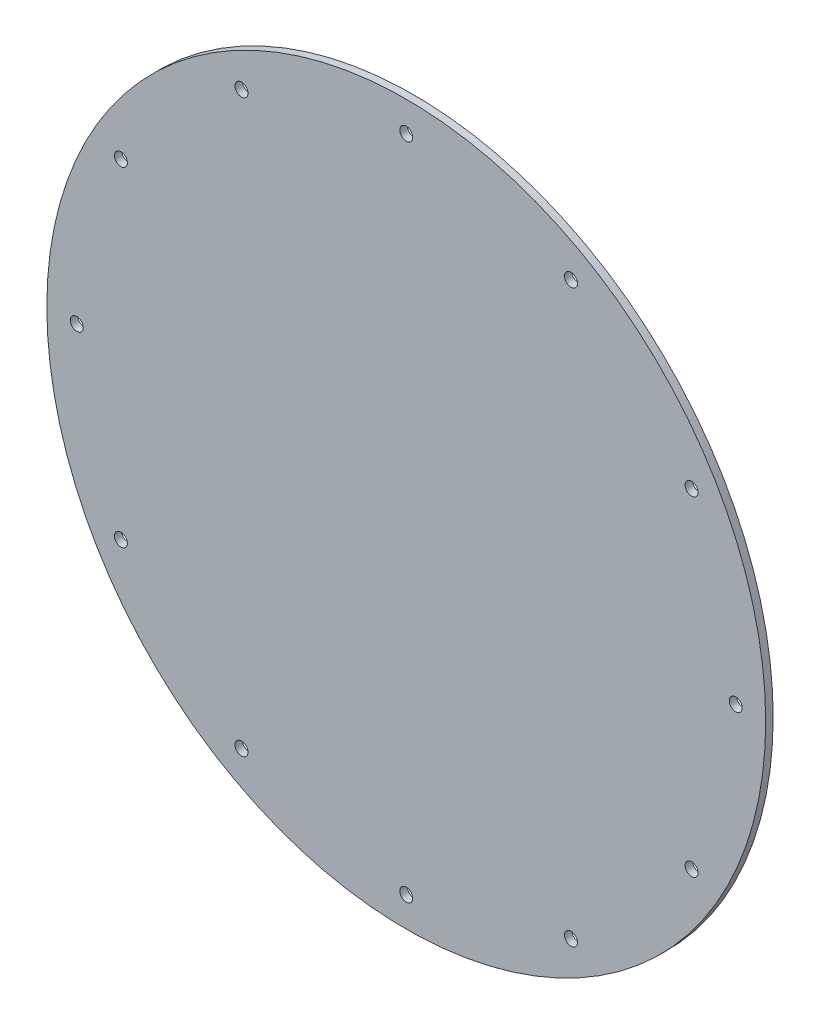
from build123d import *

# Parameters (mm, degrees)
SKETCH1_R           = 609.6
BOSS_EXTRUDE1_DEPTH = 12.7
SKETCH2_R           = 11
CUT_EXTRUDE1_DEPTH  = 12.7


with BuildPart() as part:
    # Sketch1 → Boss-Extrude1 (new body)
    with BuildSketch(Plane.XY):
        Circle(SKETCH1_R)
    extrude(amount=BOSS_EXTRUDE1_DEPTH)

    # Sketch2 → Cut-Extrude1 (cut)
    with BuildSketch(Plane.XY):
        with Locations((0, 558.8)):
            Circle(SKETCH2_R)
        with Locations((279.4, 483.934995635)):
            Circle(SKETCH2_R)
        with Locations((483.934995635, 279.4)):
            Circle(SKETCH2_R)
        with Locations((558.8, 0)):
            Circle(SKETCH2_R)
        with Locations((483.934995635, -279.4)):
            Circle(SKETCH2_R)
        with Locations((279.4, -483.934995635)):
            Circle(SKETCH2_R)
        with Locations((0, -558.8)):
            Circle(SKETCH2_R)
        with Locations((-279.4, -483.934995635)):
            Circle(SKETCH2_R)
        with Locations((-483.934995635, -279.4)):
            Circle(SKETCH2_R)
        with Locations((-558.8, 0)):
            Circle(SKETCH2_R)
        with Locations((-483.934995635, 279.4)):
            Circle(SKETCH2_R)
        with Locations((-279.4, 483.934995635)):
            Circle(SKETCH2_R)
    extrude(amount=CUT_EXTRUDE1_DEPTH, mode=Mode.SUBTRACT)


solid = part.part
